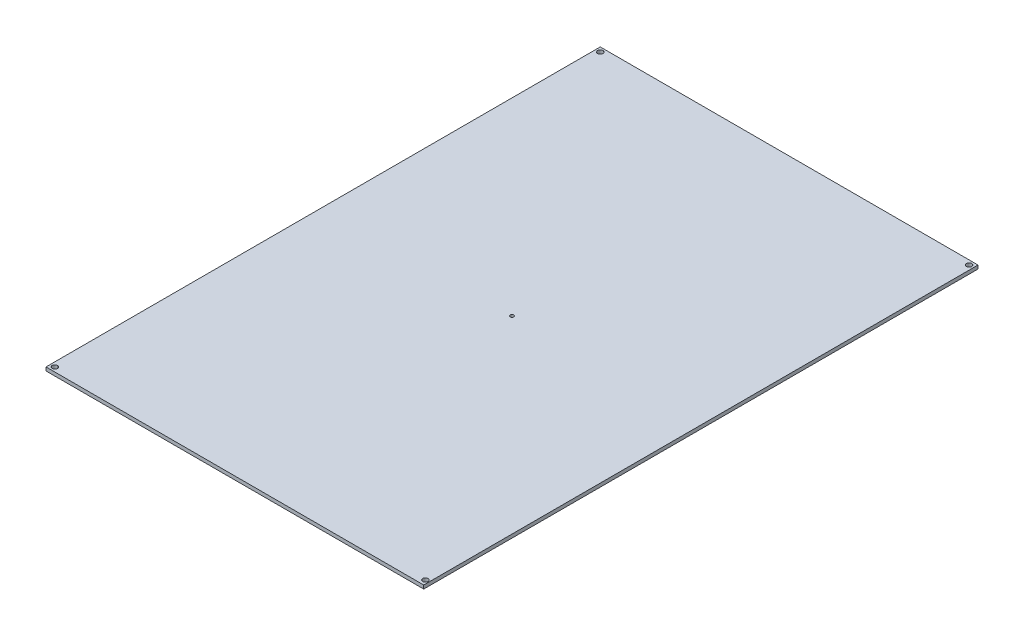
from build123d import *

# Parameters (mm, degrees)
SKETCH_1_W      = 214
SKETCH_1_H      = 314
SKETCH_1_R      = 1.5
SKETCH_1_R_2    = 1
EXTRUDE_1_DEPTH = 2


with BuildPart() as part:
    # Эскиз1 → Бобышка-Вытянуть1 (new body)
    with BuildSketch(Plane(origin=(0, 0, 0), x_dir=(1, 0, 0), z_dir=(0, 1, 0))):
        Rectangle(SKETCH_1_W, SKETCH_1_H)
        with Locations(Location((-104.5, 154.5, 0), (0, 0, 270))):
            Circle(SKETCH_1_R, mode=Mode.SUBTRACT)
        with Locations(Location((104.5, 154.5, 0), (0, 0, 270))):
            Circle(SKETCH_1_R, mode=Mode.SUBTRACT)
        with Locations(Location((105.008881012, -154.078451579, 0), (0, 0, 270))):
            Circle(SKETCH_1_R, mode=Mode.SUBTRACT)
        with Locations(Location((-104.496841995, -154.496841995, 0), (0, 0, 270))):
            Circle(SKETCH_1_R, mode=Mode.SUBTRACT)
        with Locations(Location((0, 0, 0), (0, 0, 270))):
            Circle(SKETCH_1_R_2, mode=Mode.SUBTRACT)
    extrude(amount=EXTRUDE_1_DEPTH)


solid = part.part
